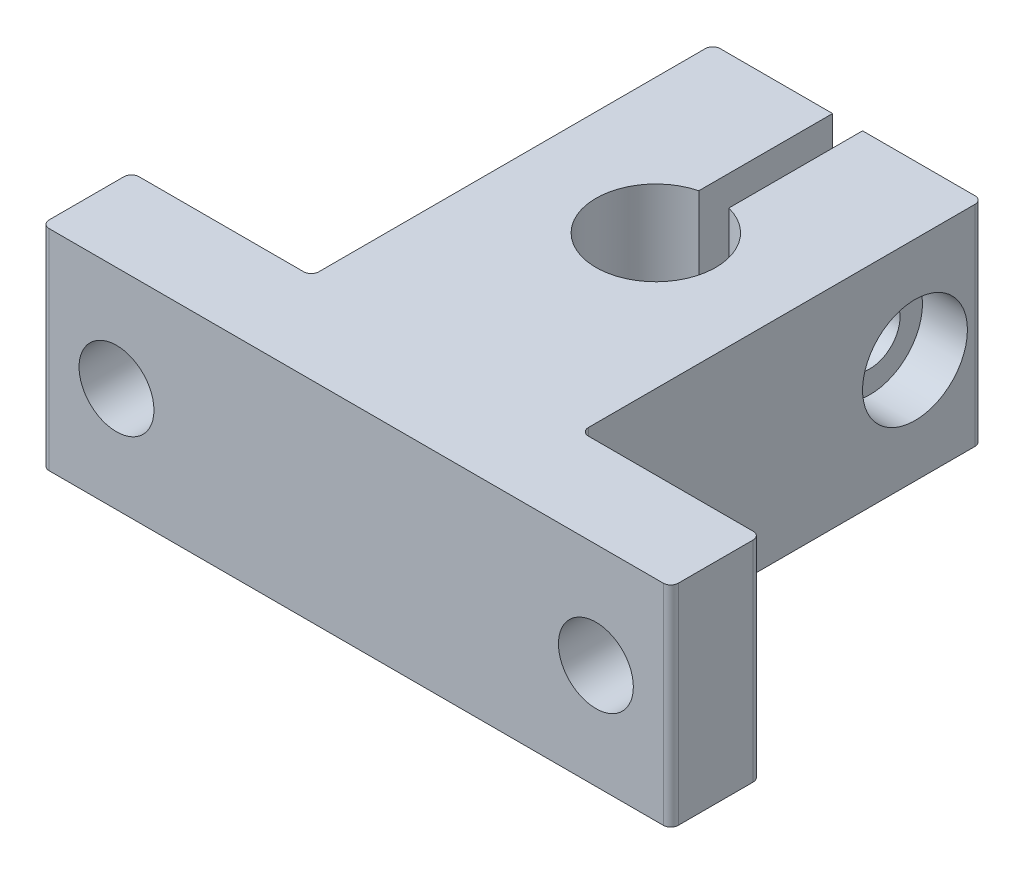
from build123d import *

# Parameters (mm, degrees)
BOSS_EXTRUDE1_DEPTH = 14
SKETCH2_R           = 2
CUT_EXTRUDE1_DEPTH  = 20
SKETCH3_R           = 3.5
CUT_EXTRUDE2_DEPTH  = 3
SKETCH4_R           = 2.5
CUT_EXTRUDE3_DEPTH  = 8
FILLET1_R           = 0.5


with BuildPart() as part:
    # Sketch1 → Boss-Extrude1 (new body)
    with BuildSketch(Plane(origin=(0, 0, 0), x_dir=(1, 0, 0), z_dir=(0, 1, 0))):
        with BuildLine():
            Line((9, -14), (21, -14))
            Line((21, -14), (21, -20))
            Line((21, -20), (-21, -20))
            Line((-21, -20), (-21, -14))
            Line((-21, -14), (-9, -14))
            Line((-9, -14), (-9, 12.8))
            Line((-9, 12.8), (-1, 12.8))
            Line((-1, 12.8), (-1, 3.872983346))
            ThreePointArc((-1, 3.872983346), (0, -4), (1, 3.872983346))
            Line((1, 3.872983346), (1, 12.8))
            Line((1, 12.8), (9, 12.8))
            Line((9, 12.8), (9, -14))
        make_face()
    extrude(amount=BOSS_EXTRUDE1_DEPTH)

    # Sketch2 → Cut-Extrude1 (cut)
    with BuildSketch(Plane(origin=(9, 0, 0), x_dir=(0, 0, -1), z_dir=(1, 0, 0))):
        with Locations((8.3, 7)):
            Circle(SKETCH2_R)
    extrude(amount=-CUT_EXTRUDE1_DEPTH, mode=Mode.SUBTRACT)

    # Sketch3 → Cut-Extrude2 (cut)
    with BuildSketch(Plane(origin=(9, 0, 0), x_dir=(0, 0, -1), z_dir=(1, 0, 0))):
        with Locations((8.3, 7)):
            Circle(SKETCH3_R)
    extrude(amount=-CUT_EXTRUDE2_DEPTH, mode=Mode.SUBTRACT)

    # Sketch4 → Cut-Extrude3 (cut)
    with BuildSketch(Plane.XY.offset(20)):
        with Locations((-16, 7)):
            Circle(SKETCH4_R)
        with Locations((16, 7)):
            Circle(SKETCH4_R)
    extrude(amount=-CUT_EXTRUDE3_DEPTH, mode=Mode.SUBTRACT)

    # Fillet1
    fillet1_edges = [part.edges().sort_by_distance(p)[0] for p in [
        (-21, 7, 14),
        (-9, 7, 14),
        (-9, 7, -12.8),
        (9, 7, -12.8),
        (9, 7, 14),
        (21, 7, 14),
        (21, 7, 20),
        (-21, 7, 20),
    ]]
    fillet(fillet1_edges, radius=FILLET1_R)


solid = part.part
